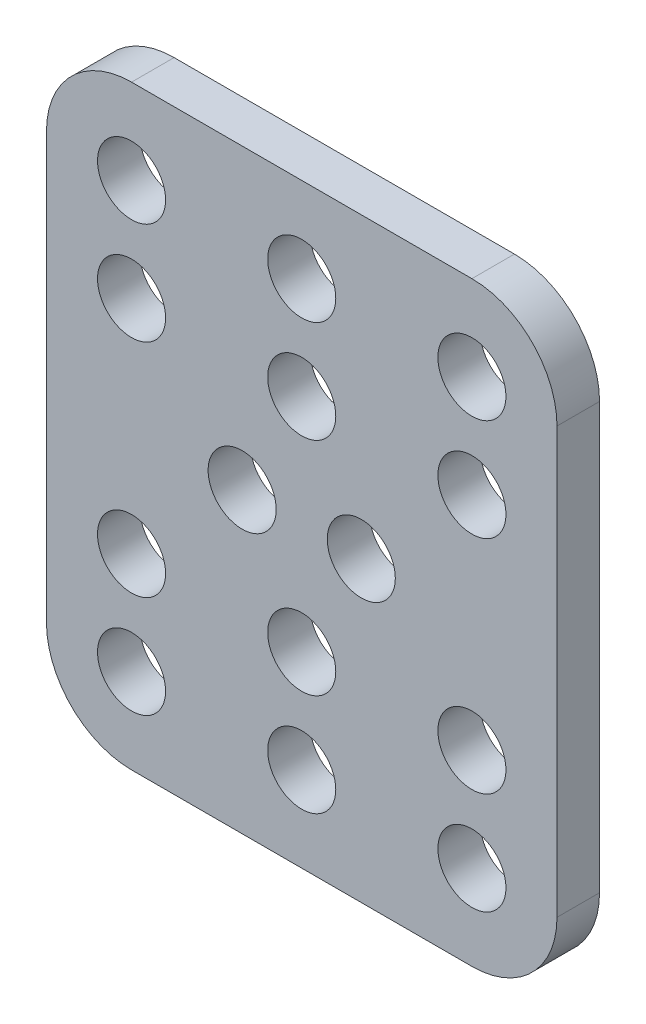
from build123d import *

# Parameters (mm, degrees)
SKETCH1_R           = 4
BOSS_EXTRUDE1_DEPTH = 5


with BuildPart() as part:
    # Sketch1 → Boss-Extrude1 (new body)
    with BuildSketch(Plane.XY):
        with BuildLine():
            Line((-20, 35), (20, 35))
            ThreePointArc((20, 35), (27.071067812, 32.071067812), (30, 25))
            Line((30, 25), (30, -25))
            ThreePointArc((30, -25), (27.071067812, -32.071067812), (20, -35))
            Line((20, -35), (-20, -35))
            ThreePointArc((-20, -35), (-27.071067812, -32.071067812), (-30, -25))
            Line((-30, -25), (-30, 25))
            ThreePointArc((-30, 25), (-27.071067812, 32.071067812), (-20, 35))
        make_face()
        with Locations((7, 0)):
            Circle(SKETCH1_R, mode=Mode.SUBTRACT)
        with Locations((-7, 0)):
            Circle(SKETCH1_R, mode=Mode.SUBTRACT)
        with Locations((-20, 25)):
            Circle(SKETCH1_R, mode=Mode.SUBTRACT)
        with Locations((20, 25)):
            Circle(SKETCH1_R, mode=Mode.SUBTRACT)
        with Locations((-20, -25)):
            Circle(SKETCH1_R, mode=Mode.SUBTRACT)
        with Locations((20, -25)):
            Circle(SKETCH1_R, mode=Mode.SUBTRACT)
        with Locations((0, -25)):
            Circle(SKETCH1_R, mode=Mode.SUBTRACT)
        with Locations((0, -13)):
            Circle(SKETCH1_R, mode=Mode.SUBTRACT)
        with Locations((0, 25)):
            Circle(SKETCH1_R, mode=Mode.SUBTRACT)
        with Locations((-20, -13)):
            Circle(SKETCH1_R, mode=Mode.SUBTRACT)
        with Locations((20, -13)):
            Circle(SKETCH1_R, mode=Mode.SUBTRACT)
        with Locations((-20, 13)):
            Circle(SKETCH1_R, mode=Mode.SUBTRACT)
        with Locations((0, 13)):
            Circle(SKETCH1_R, mode=Mode.SUBTRACT)
        with Locations((20, 13)):
            Circle(SKETCH1_R, mode=Mode.SUBTRACT)
    extrude(amount=BOSS_EXTRUDE1_DEPTH)


solid = part.part
